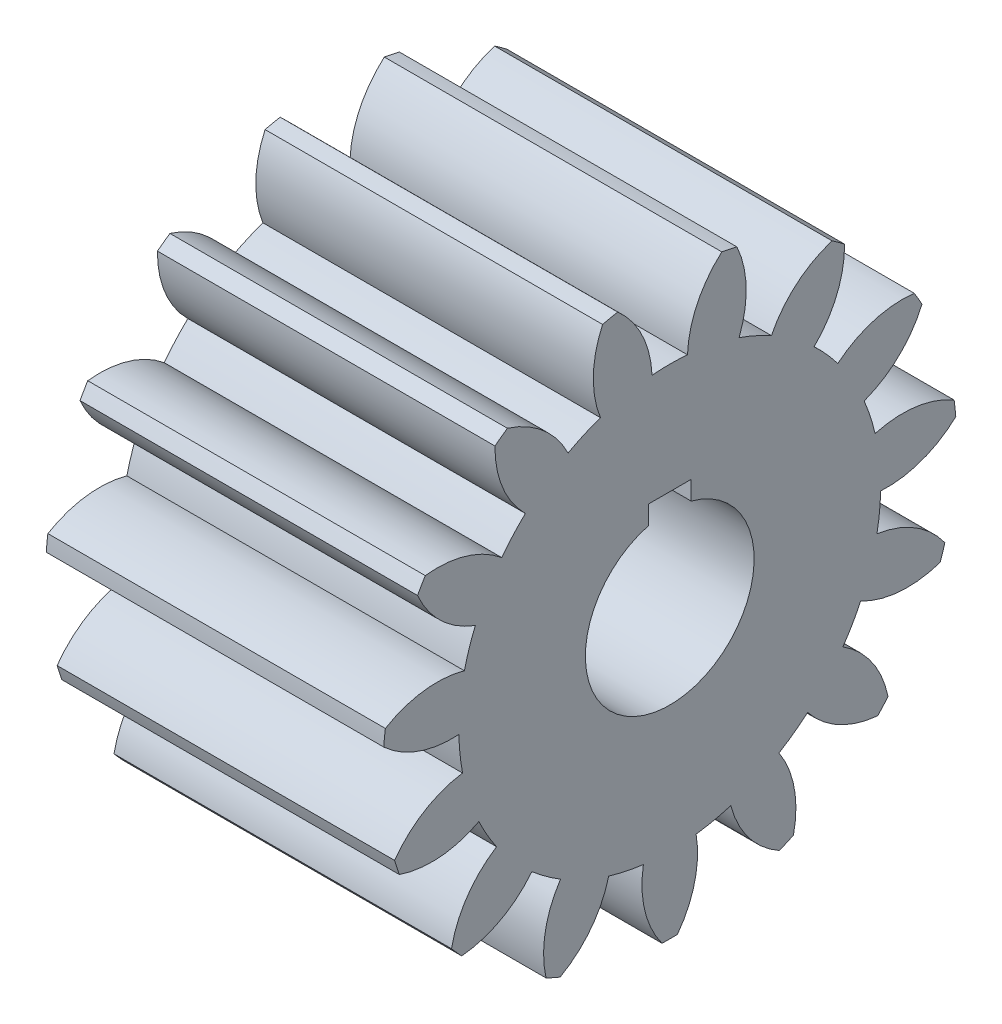
from build123d import *

# Parameters (mm, degrees)
BASPROSKE_W     = 50
BASPROSKE_H     = 42.5
TOOTHCUT_DEPTH  = 79.182478856
TEETHCUTS_COUNT = 15
TEETHCUTS_ANGLE = 336
BORSKE_R        = 12.5
BORE_DEPTH      = 50.0000508
KEYSKE_W        = 6.35
KEYSKE_H        = 14.88125
KEYWAY_DEPTH    = 50.0000508


with BuildPart() as part:
    # BasProSke → Base-Revolve (revolve)
    with BuildSketch(Plane(origin=(0, 0, 0), x_dir=(1, 0, 0), z_dir=(0, 1, 0)), mode=Mode.PRIVATE) as base_revolve_sk:
        with Locations((25, 21.25)):
            Rectangle(BASPROSKE_W, BASPROSKE_H)
    revolve(base_revolve_sk.sketch.rotate(Axis((-10, 0, 0), (1, 0, 0)), 180), axis=Axis((-10, 0, 0), (1, 0, 0)))

    # TooCutSke → ToothCut (cut, through all)
    with BuildSketch(Plane(origin=(0, 0, 0), x_dir=(0, 0, -1), z_dir=(1, 0, 0))):
        with BuildLine():
            ThreePointArc((2.624472836, 31.138595719), (0, 31.249), (-2.624472836, 31.138595719))
            ThreePointArc((-2.624472836, 31.138595719), (-4.084227986, 37.002862003), (-7.739685892, 41.815151649))
            ThreePointArc((-7.739685892, 41.815151649), (0, 42.5254), (7.739685892, 41.815151649))
            ThreePointArc((7.739685892, 41.815151649), (4.084227986, 37.002862003), (2.624472836, 31.138595719))
        make_face()
    toothcut = extrude(amount=TOOTHCUT_DEPTH, mode=Mode.SUBTRACT)

    # TeethCuts: ToothCut ×15 about axis
    teethcuts_axis = Axis((-10, 0, 0), (1, 0, 0))
    for i in range(1, TEETHCUTS_COUNT):
        add(toothcut.rotate(teethcuts_axis, i * TEETHCUTS_ANGLE / (TEETHCUTS_COUNT - 1)), mode=Mode.SUBTRACT)

    # BorSke → Bore (cut, symmetric)
    with BuildSketch(Plane(origin=(0, 0, 0), x_dir=(0, 0, -1), z_dir=(1, 0, 0))):
        with Locations(Location((0, 0, 0), (0, 0, 180))):
            Circle(BORSKE_R)
    extrude(amount=BORE_DEPTH, both=True, mode=Mode.SUBTRACT)

    # KeySke → Keyway (cut, symmetric)
    with BuildSketch(Plane(origin=(0, 0, 0), x_dir=(0, 0, -1), z_dir=(1, 0, 0))):
        with Locations((0, 7.440625)):
            Rectangle(KEYSKE_W, KEYSKE_H)
    extrude(amount=KEYWAY_DEPTH, both=True, mode=Mode.SUBTRACT)


solid = part.part
